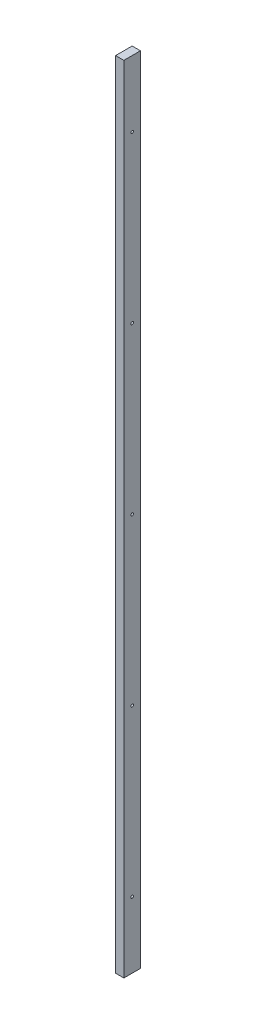
from build123d import *

# Parameters (mm, degrees)
SKETCH_1_W          = 25
SKETCH_1_H          = 50
EXTRUDE_1_DEPTH     = 2400
SKETCH_2_R          = 4
CUT_EXTRUDE_1_DEPTH = 2400


with BuildPart() as part:
    # Эскиз1 → Бобышка-Вытянуть1 (new body)
    with BuildSketch(Plane(origin=(0, 0, 0), x_dir=(1, 0, 0), z_dir=(0, 1, 0))):
        Rectangle(SKETCH_1_W, SKETCH_1_H)
    extrude(amount=EXTRUDE_1_DEPTH)

    # Эскиз2 → Вырез-Вытянуть1 (cut)
    with BuildSketch(Plane(origin=(12.5, 0, 0), x_dir=(0, 0, -1), z_dir=(1, 0, 0))):
        with Locations((0, 2200)):
            Circle(SKETCH_2_R)
        with Locations((0, 1700)):
            Circle(SKETCH_2_R)
        with Locations((0, 1200)):
            Circle(SKETCH_2_R)
        with Locations((0, 700)):
            Circle(SKETCH_2_R)
        with Locations((0, 200)):
            Circle(SKETCH_2_R)
    extrude(amount=-CUT_EXTRUDE_1_DEPTH, mode=Mode.SUBTRACT)


solid = part.part
